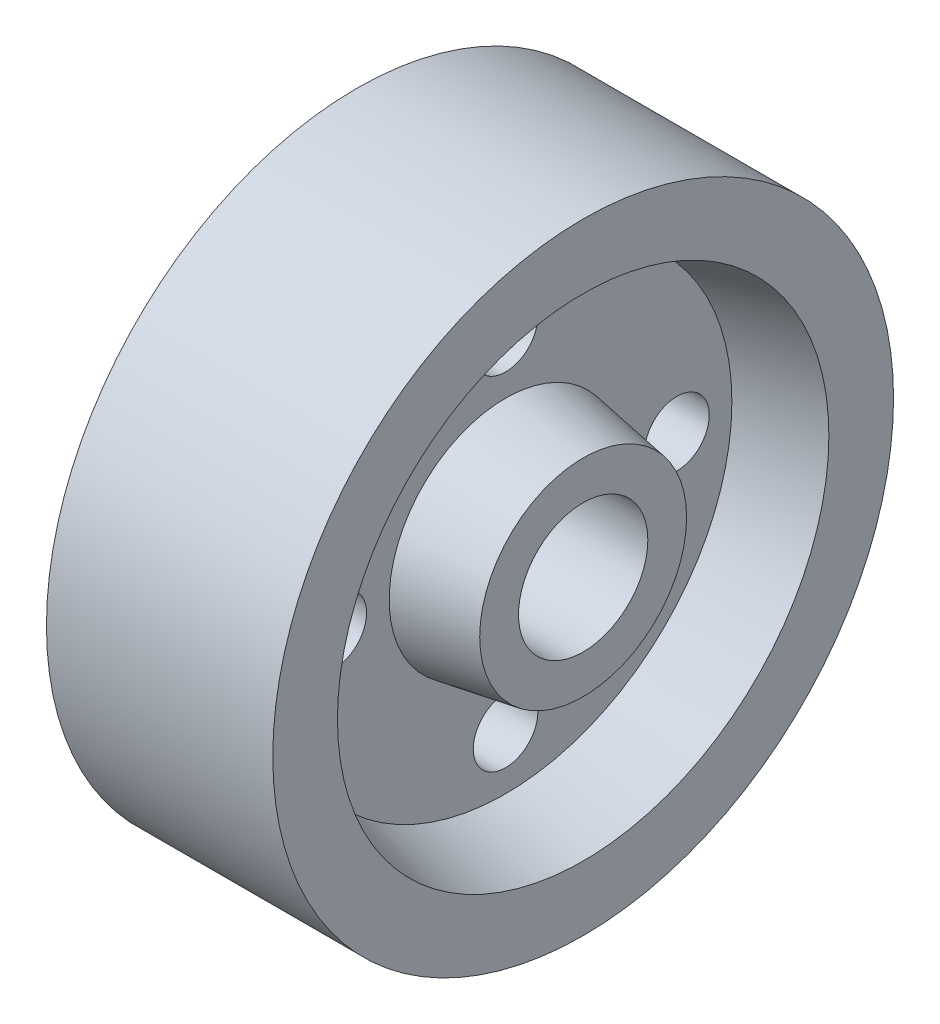
from build123d import *

# Parameters (mm, degrees)
CUT_EXTRUDE3_START = -40.72
SKETCH15_R         = 10
CUT_EXTRUDE3_DEPTH = 40.72
SKETCH16_R         = 5
CUT_EXTRUDE4_DEPTH = 40.72


with BuildPart() as part:
    # Sketch1 → Revolve5 (revolve)
    with BuildSketch(Plane.XY, mode=Mode.PRIVATE) as revolve5_sk:
        Polygon((0, 0), (0, 10), (-12, 10), (-12, 16), (0, 18), (0, 35), (-12, 38), (-12, 48), (23, 48), (23, 38), (11, 35), (11, 18), (23, 16), (23, 10), (11, 10), (11, 0), align=None)
    revolve(revolve5_sk.sketch.rotate(Axis((11, 0, 0), (-1, 0, 0)), 90), axis=Axis((11, 0, 0), (-1, 0, 0)))

    # Sketch15 → Cut-Extrude3 (cut)
    with BuildSketch(Plane(origin=(11, 0, 0), x_dir=(0, 0, -1), z_dir=(1, 0, 0)).offset(CUT_EXTRUDE3_START)):
        Circle(SKETCH15_R)
    extrude(amount=CUT_EXTRUDE3_DEPTH, mode=Mode.SUBTRACT)

    # Sketch16 → Cut-Extrude4 (cut)
    with BuildSketch(Plane.ZY.offset(12)):
        with Locations((0, 26.5)):
            Circle(SKETCH16_R)
        with Locations((26.5, 0)):
            Circle(SKETCH16_R)
        with Locations((0, -26.5)):
            Circle(SKETCH16_R)
        with Locations((-26.5, 0)):
            Circle(SKETCH16_R)
    extrude(amount=-CUT_EXTRUDE4_DEPTH, mode=Mode.SUBTRACT)


solid = part.part
